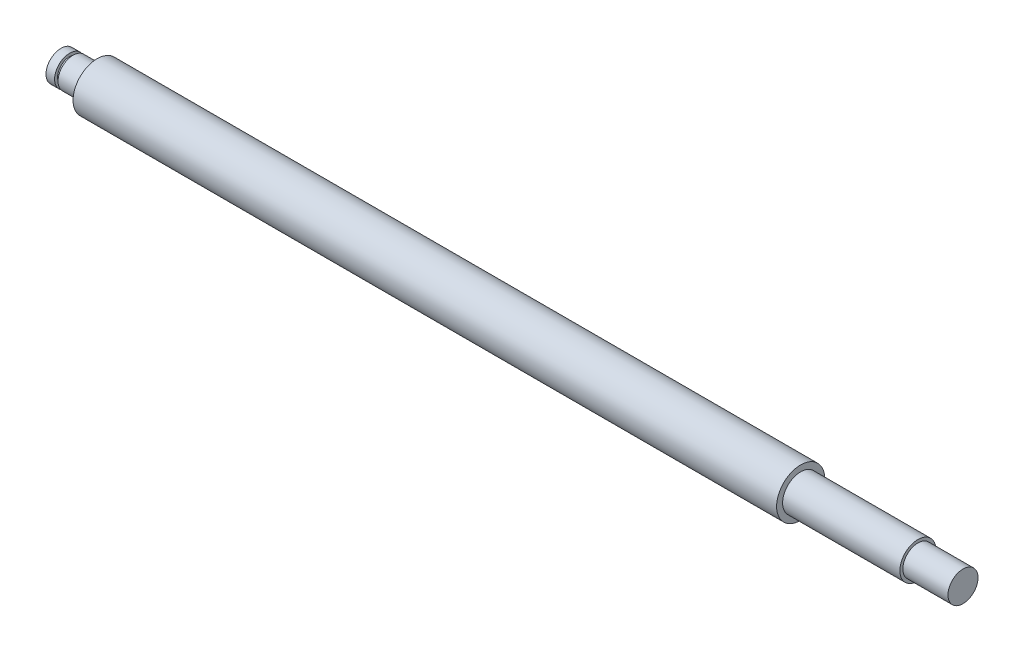
from build123d import *


with BuildPart() as part:
    # Esquisse1 → Révolution1 (revolve)
    with BuildSketch(Plane.XY, mode=Mode.PRIVATE) as r_volution1_sk:
        Polygon((-88.223286033, 0), (-88.223286033, 5), (-85.369889122, 5), (-85.369889122, 4), (-84.219889122, 4), (-84.219889122, 5), (-76.219889122, 5), (-76.219889122, 8), (157.780110878, 8), (157.780110878, 6), (184.780110878, 6), (196.780110878, 6), (196.780110878, 5), (211.780110878, 5), (211.780110878, 0), align=None)
    revolve(r_volution1_sk.sketch.rotate(Axis((-89.400555638, 0, 0), (1, 0, 0)), 90), axis=Axis((-89.400555638, 0, 0), (1, 0, 0)))


solid = part.part
